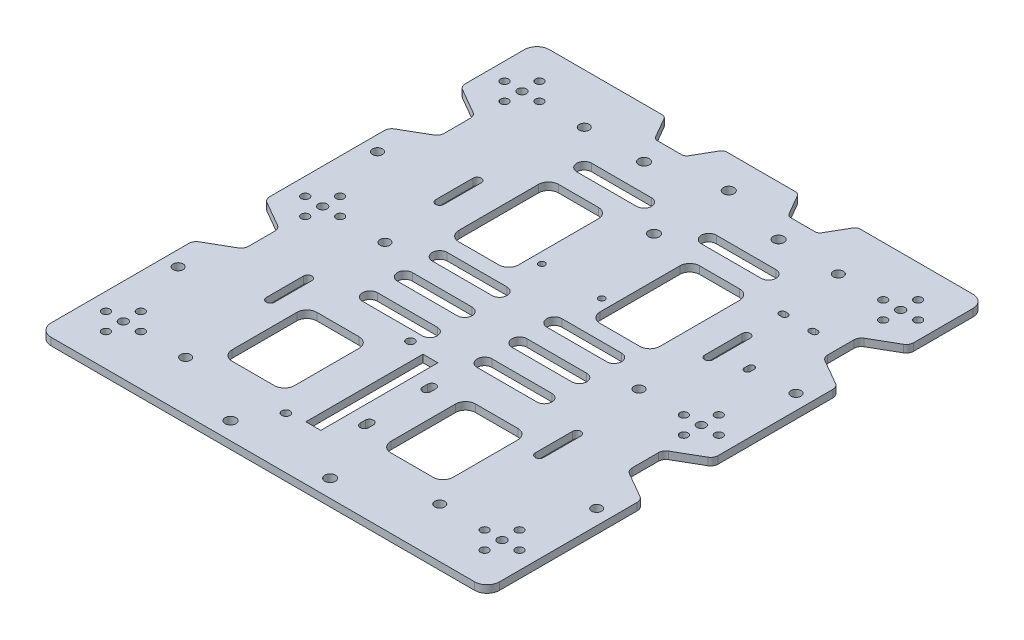
from build123d import *

# Parameters (mm, degrees)
SKETCH_1_W             = 180
SKETCH_1_H             = 200
SKETCH_1_R             = 1.75
SKETCH_1_R_2           = 1.6
EXTRUDE_1_DEPTH        = 3
SKETCH_2_R             = 2
CUT_EXTRUDE_1_DEPTH    = 3
CUT_EXTRUDE_2502_DEPTH = 7.5
SKETCH_4_R             = 2.15
CUT_EXTRUDE_3175_DEPTH = 7.5
SKETCH_5_W             = 6
SKETCH_5_H             = 47
CUT_EXTRUDE_3418_DEPTH = 7.5
SKETCH_6_R             = 1.65
CUT_EXTRUDE_3868_DEPTH = 10
SKETCH_7_R             = 2.15
CUT_EXTRUDE_4040_DEPTH = 10
SKETCH_8_W             = 24
SKETCH_8_H             = 40
SKETCH_8_W_2           = 25
SKETCH_8_H_2           = 34
CUT_EXTRUDE_4845_DEPTH = 10
CUT_EXTRUDE_7_DEPTH    = 10
CUT_EXTRUDE_8_DEPTH    = 10
FILLET_1_R             = 4
FILLET_2_R             = 3
FILLET_3_R             = 2
FILLET_4_R             = 5
SKETCH_12_R            = 1.25
CUT_EXTRUDE_9_DEPTH    = 10


with BuildPart() as part:
    # 草图1 → 凸台-拉伸1 (new body)
    with BuildSketch(Plane(origin=(0, 0, 0), x_dir=(1, 0, 0), z_dir=(0, 1, 0))):
        Rectangle(SKETCH_1_W, SKETCH_1_H)
        with Locations(Location((-76, 80, 0), (0, 0, 270))):
            Circle(SKETCH_1_R, mode=Mode.SUBTRACT)
        with Locations(Location((-83, 80, 0), (0, 0, 270))):
            Circle(SKETCH_1_R_2, mode=Mode.SUBTRACT)
        with Locations(Location((-76, 87, 0), (0, 0, 270))):
            Circle(SKETCH_1_R_2, mode=Mode.SUBTRACT)
        with Locations(Location((-69, 80, 0), (0, 0, 90))):
            Circle(SKETCH_1_R_2, mode=Mode.SUBTRACT)
        with Locations(Location((-76, 73, 0), (0, 0, 90))):
            Circle(SKETCH_1_R_2, mode=Mode.SUBTRACT)
        with Locations(Location((-76, 0, 0), (0, 0, 270))):
            Circle(SKETCH_1_R, mode=Mode.SUBTRACT)
        with Locations(Location((-83, 0, 0), (0, 0, 270))):
            Circle(SKETCH_1_R_2, mode=Mode.SUBTRACT)
        with Locations(Location((-76, 7, 0), (0, 0, 270))):
            Circle(SKETCH_1_R_2, mode=Mode.SUBTRACT)
        with Locations(Location((-76, -7, 0), (0, 0, 90))):
            Circle(SKETCH_1_R_2, mode=Mode.SUBTRACT)
        with Locations(Location((-69, 0, 0), (0, 0, 90))):
            Circle(SKETCH_1_R_2, mode=Mode.SUBTRACT)
        with Locations(Location((-76, -73, 0), (0, 0, 270))):
            Circle(SKETCH_1_R_2, mode=Mode.SUBTRACT)
        with Locations(Location((-69, -80, 0), (0, 0, 270))):
            Circle(SKETCH_1_R_2, mode=Mode.SUBTRACT)
        with Locations(Location((-76, -80, 0), (0, 0, 90))):
            Circle(SKETCH_1_R, mode=Mode.SUBTRACT)
        with Locations(Location((-83, -80, 0), (0, 0, 90))):
            Circle(SKETCH_1_R_2, mode=Mode.SUBTRACT)
        with Locations(Location((-76, -87, 0), (0, 0, 90))):
            Circle(SKETCH_1_R_2, mode=Mode.SUBTRACT)
        with Locations(Location((76, -87, 0), (0, 0, 270))):
            Circle(SKETCH_1_R_2, mode=Mode.SUBTRACT)
        with Locations(Location((83, -80, 0), (0, 0, 270))):
            Circle(SKETCH_1_R_2, mode=Mode.SUBTRACT)
        with Locations(Location((76, -80, 0), (0, 0, 270))):
            Circle(SKETCH_1_R, mode=Mode.SUBTRACT)
        with Locations(Location((69, -80, 0), (0, 0, 90))):
            Circle(SKETCH_1_R_2, mode=Mode.SUBTRACT)
        with Locations(Location((76, -73, 0), (0, 0, 90))):
            Circle(SKETCH_1_R_2, mode=Mode.SUBTRACT)
        with Locations(Location((69, 0, 0), (0, 0, 270))):
            Circle(SKETCH_1_R_2, mode=Mode.SUBTRACT)
        with Locations(Location((76, -7, 0), (0, 0, 270))):
            Circle(SKETCH_1_R_2, mode=Mode.SUBTRACT)
        with Locations(Location((76, 7, 0), (0, 0, 90))):
            Circle(SKETCH_1_R_2, mode=Mode.SUBTRACT)
        with Locations(Location((83, 0, 0), (0, 0, 90))):
            Circle(SKETCH_1_R_2, mode=Mode.SUBTRACT)
        with Locations(Location((76, 0, 0), (0, 0, 90))):
            Circle(SKETCH_1_R, mode=Mode.SUBTRACT)
        with Locations(Location((76, 73, 0), (0, 0, 270))):
            Circle(SKETCH_1_R_2, mode=Mode.SUBTRACT)
        with Locations(Location((69, 80, 0), (0, 0, 270))):
            Circle(SKETCH_1_R_2, mode=Mode.SUBTRACT)
        with Locations(Location((76, 87, 0), (0, 0, 90))):
            Circle(SKETCH_1_R_2, mode=Mode.SUBTRACT)
        with Locations(Location((83, 80, 0), (0, 0, 90))):
            Circle(SKETCH_1_R_2, mode=Mode.SUBTRACT)
        with Locations(Location((76, 80, 0), (0, 0, 90))):
            Circle(SKETCH_1_R, mode=Mode.SUBTRACT)
    extrude(amount=EXTRUDE_1_DEPTH)

    # 草图2 → 切除-拉伸1 (cut)
    with BuildSketch(Plane(origin=(0, 3, 0), x_dir=(1, 0, 0), z_dir=(0, 1, 0))):
        with Locations(Location((-84, 30, 0), (0, 0, 270))):
            Circle(SKETCH_2_R)
        with Locations(Location((-84, -50, 0), (0, 0, 270))):
            Circle(SKETCH_2_R)
        with Locations(Location((-51, 0, 0), (0, 0, 270))):
            Circle(SKETCH_2_R)
        with Locations(Location((-51, -80, 0), (0, 0, 270))):
            Circle(SKETCH_2_R)
        with Locations(Location((-51, 80, 0), (0, 0, 90))):
            Circle(SKETCH_2_R)
        with Locations(Location((51, 80, 0), (0, 0, 270))):
            Circle(SKETCH_2_R)
        with Locations(Location((51, -80, 0), (0, 0, 90))):
            Circle(SKETCH_2_R)
        with Locations(Location((51, 0, 0), (0, 0, 90))):
            Circle(SKETCH_2_R)
        with Locations(Location((84, -50, 0), (0, 0, 90))):
            Circle(SKETCH_2_R)
        with Locations(Location((84, 30, 0), (0, 0, 90))):
            Circle(SKETCH_2_R)
    extrude(amount=-CUT_EXTRUDE_1_DEPTH, mode=Mode.SUBTRACT)

    # 草图3 → Cut-Extrude 2502 (cut)
    with BuildSketch(Plane(origin=(0, 3, 0), x_dir=(1, 0, 0), z_dir=(0, 1, 0))):
        with BuildLine():
            Line((-55.65, 25), (-55.65, 40))
            ThreePointArc((-55.65, 40), (-54, 41.65), (-52.35, 40))
            Line((-52.35, 40), (-52.35, 25))
            ThreePointArc((-52.35, 25), (-54, 23.35), (-55.65, 25))
        make_face()
        with BuildLine():
            Line((-55.65, -43), (-55.65, -28))
            ThreePointArc((-55.65, -28), (-54, -26.35), (-52.35, -28))
            Line((-52.35, -28), (-52.35, -43))
            ThreePointArc((-52.35, -43), (-54, -44.65), (-55.65, -43))
        make_face()
        with BuildLine():
            Line((55.65, -43), (55.65, -28))
            ThreePointArc((55.65, -28), (54, -26.35), (52.35, -28))
            Line((52.35, -28), (52.35, -43))
            ThreePointArc((52.35, -43), (54, -44.65), (55.65, -43))
        make_face()
        with BuildLine():
            Line((55.65, 25), (55.65, 40))
            ThreePointArc((55.65, 40), (54, 41.65), (52.35, 40))
            Line((52.35, 40), (52.35, 25))
            ThreePointArc((52.35, 25), (54, 23.35), (55.65, 25))
        make_face()
    extrude(amount=-CUT_EXTRUDE_2502_DEPTH, mode=Mode.SUBTRACT)

    # 草图4 → Cut-Extrude 3175 (cut)
    with BuildSketch(Plane(origin=(0, 3, 0), x_dir=(1, 0, 0), z_dir=(0, 1, 0))):
        with Locations(Location((0, 87, 0), (0, 0, 270))):
            Circle(SKETCH_4_R)
        with Locations(Location((0, 57, 0), (0, 0, 270))):
            Circle(SKETCH_4_R)
        with Locations(Location((-27, 80, 0), (0, 0, 270))):
            Circle(SKETCH_4_R)
        with Locations(Location((27, 80, 0), (0, 0, 90))):
            Circle(SKETCH_4_R)
    extrude(amount=-CUT_EXTRUDE_3175_DEPTH, mode=Mode.SUBTRACT)

    # 草图5 → Cut-Extrude 3418 (cut)
    with BuildSketch(Plane(origin=(0, 3, 0), x_dir=(1, 0, 0), z_dir=(0, 1, 0))):
        with Locations((-1.5, -54.75)):
            Rectangle(SKETCH_5_W, SKETCH_5_H)
    extrude(amount=-CUT_EXTRUDE_3418_DEPTH, mode=Mode.SUBTRACT)

    # 草图6 → Cut-Extrude 3868 (cut)
    with BuildSketch(Plane(origin=(0, 3, 0), x_dir=(1, 0, 0), z_dir=(0, 1, 0))):
        with Locations(Location((-11.5, -29.25, 0), (0, 0, 270))):
            Circle(SKETCH_6_R)
        with Locations(Location((-11.5, -79.25, 0), (0, 0, 90))):
            Circle(SKETCH_6_R)
        with BuildLine():
            Line((6.85, -42.75), (6.85, -40.75))
            ThreePointArc((6.85, -40.75), (8.5, -39.1), (10.15, -40.75))
            Line((10.15, -40.75), (10.15, -42.75))
            ThreePointArc((10.15, -42.75), (8.5, -44.4), (6.85, -42.75))
        make_face()
        with BuildLine():
            Line((6.85, -65.75), (6.85, -67.75))
            ThreePointArc((6.85, -67.75), (8.5, -69.4), (10.15, -67.75))
            Line((10.15, -67.75), (10.15, -65.75))
            ThreePointArc((10.15, -65.75), (8.5, -64.1), (6.85, -65.75))
        make_face()
    extrude(amount=-CUT_EXTRUDE_3868_DEPTH, mode=Mode.SUBTRACT)

    # 草图7 → Cut-Extrude 4040 (cut)
    with BuildSketch(Plane(origin=(0, 3, 0), x_dir=(1, 0, 0), z_dir=(0, 1, 0))):
        with Locations(Location((-20, -93, 0), (0, 0, 270))):
            Circle(SKETCH_7_R)
        with Locations(Location((20, -93, 0), (0, 0, 90))):
            Circle(SKETCH_7_R)
    extrude(amount=-CUT_EXTRUDE_4040_DEPTH, mode=Mode.SUBTRACT)

    # 草图8 → Cut-Extrude 4845 (cut)
    with BuildSketch(Plane(origin=(0, 3, 0), x_dir=(1, 0, 0), z_dir=(0, 1, 0))):
        with Locations((-28.35, 35)):
            Rectangle(SKETCH_8_W, SKETCH_8_H)
        with Locations((-31.85, -55)):
            Rectangle(SKETCH_8_W_2, SKETCH_8_H_2)
        with Locations((31.85, -55)):
            Rectangle(SKETCH_8_W_2, SKETCH_8_H_2)
        with Locations((28.35, 35)):
            Rectangle(SKETCH_8_W, SKETCH_8_H)
        with BuildLine():
            Line((-35, 9), (-11, 9))
            ThreePointArc((-11, 9), (-8, 6), (-11, 3))
            Line((-11, 3), (-35, 3))
            ThreePointArc((-35, 3), (-38, 6), (-35, 9))
        make_face()
        with BuildLine():
            Line((-35, -5), (-11, -5))
            ThreePointArc((-11, -5), (-8, -8), (-11, -11))
            Line((-11, -11), (-35, -11))
            ThreePointArc((-35, -11), (-38, -8), (-35, -5))
        make_face()
        with BuildLine():
            Line((-35, -25), (-11, -25))
            ThreePointArc((-11, -25), (-8, -22), (-11, -19))
            Line((-11, -19), (-35, -19))
            ThreePointArc((-35, -19), (-38, -22), (-35, -25))
        make_face()
        with BuildLine():
            Line((35, -25), (11, -25))
            ThreePointArc((11, -25), (8, -22), (11, -19))
            Line((11, -19), (35, -19))
            ThreePointArc((35, -19), (38, -22), (35, -25))
        make_face()
        with BuildLine():
            Line((35, -5), (11, -5))
            ThreePointArc((11, -5), (8, -8), (11, -11))
            Line((11, -11), (35, -11))
            ThreePointArc((35, -11), (38, -8), (35, -5))
        make_face()
        with BuildLine():
            Line((35, 9), (11, 9))
            ThreePointArc((11, 9), (8, 6), (11, 3))
            Line((11, 3), (35, 3))
            ThreePointArc((35, 3), (38, 6), (35, 9))
        make_face()
        with BuildLine():
            Line((-37, 69), (-13, 69))
            ThreePointArc((-13, 69), (-10, 66), (-13, 63))
            Line((-13, 63), (-37, 63))
            ThreePointArc((-37, 63), (-40, 66), (-37, 69))
        make_face()
        with BuildLine():
            Line((37, 69), (13, 69))
            ThreePointArc((13, 69), (10, 66), (13, 63))
            Line((13, 63), (37, 63))
            ThreePointArc((37, 63), (40, 66), (37, 69))
        make_face()
    extrude(amount=-CUT_EXTRUDE_4845_DEPTH, mode=Mode.SUBTRACT)

    # 草图10 → 切除-拉伸7 (cut)
    with BuildSketch(Plane(origin=(0, 3, 0), x_dir=(1, 0, 0), z_dir=(0, 1, 0))):
        Polygon((-38.547005384, 100), (-32.773502692, 90), (-20.773502692, 90), (-15, 100), align=None)
        Polygon((38.547005384, 100), (32.773502692, 90), (20.773502692, 90), (15, 100), align=None)
    extrude(amount=-CUT_EXTRUDE_7_DEPTH, mode=Mode.SUBTRACT)

    # 草图11 → 切除-拉伸8 (cut)
    with BuildSketch(Plane(origin=(0, 3, 0), x_dir=(1, 0, 0), z_dir=(0, 1, 0))):
        Polygon((-90, 69.505553499), (-77, 62), (-77, 48), (-90, 40.494446501), align=None)
        Polygon((-90, -8.988893001), (-90, -38), (-77, -30.494446501), (-77, -16.494446501), align=None)
        Polygon((77, -16.494446501), (90, -8.988893001), (90, -38), (77, -30.494446501), align=None)
        Polygon((90, 40.494446501), (90, 69.505553499), (77, 62), (77, 48), align=None)
    extrude(amount=-CUT_EXTRUDE_8_DEPTH, mode=Mode.SUBTRACT)

    # 圆角1
    fillet_1_edges = [part.edges().sort_by_distance(p)[0] for p in [
        (40.35, 1.5, -55),
        (40.35, 1.5, -15),
        (16.35, 1.5, -15),
        (16.35, 1.5, -55),
        (44.35, 1.5, 38),
        (44.35, 1.5, 72),
        (19.35, 1.5, 72),
        (19.35, 1.5, 38),
        (-19.35, 1.5, 38),
        (-19.35, 1.5, 72),
        (-44.35, 1.5, 72),
        (-44.35, 1.5, 38),
        (-16.35, 1.5, -55),
        (-16.35, 1.5, -15),
        (-40.35, 1.5, -15),
        (-40.35, 1.5, -55),
    ]]
    fillet(fillet_1_edges, radius=FILLET_1_R)

    # 圆角2
    fillet_2_edges = [part.edges().sort_by_distance(p)[0] for p in [
        (-90, 1.5, -40.494446501),
        (-90, 1.5, -69.505553499),
        (-90, 1.5, 38),
        (-90, 1.5, 8.988893001),
        (90, 1.5, 38),
        (90, 1.5, 8.988893001),
        (90, 1.5, -69.505553499),
        (90, 1.5, -40.494446501),
        (77, 1.5, -48),
        (77, 1.5, -62),
        (77, 1.5, 30.494446501),
        (77, 1.5, 16.494446501),
        (-77, 1.5, 16.494446501),
        (-77, 1.5, 30.494446501),
        (-77, 1.5, -62),
        (-77, 1.5, -48),
    ]]
    fillet(fillet_2_edges, radius=FILLET_2_R)

    # 圆角3
    fillet_3_edges = [part.edges().sort_by_distance(p)[0] for p in [
        (15, 1.5, -100),
        (38.547005384, 1.5, -100),
        (-38.547005384, 1.5, -100),
        (-15, 1.5, -100),
        (-20.773502692, 1.5, -90),
        (-32.773502692, 1.5, -90),
        (32.773502692, 1.5, -90),
        (20.773502692, 1.5, -90),
    ]]
    fillet(fillet_3_edges, radius=FILLET_3_R)

    # 圆角4
    fillet_4_edges = [part.edges().sort_by_distance(p)[0] for p in [
        (90, 1.5, 100),
        (-90, 1.5, 100),
        (-90, 1.5, -100),
        (90, 1.5, -100),
    ]]
    fillet(fillet_4_edges, radius=FILLET_4_R)

    # 草图12 → 切除-拉伸9 (cut)
    with BuildSketch(Plane.XZ):
        with Locations(Location((12.03, -24, 0), (0, 0, 270))):
            Circle(SKETCH_12_R)
        with Locations(Location((-12.03, -24, 0), (0, 0, 270))):
            Circle(SKETCH_12_R)
        with BuildLine():
            Line((53.5, -53.75), (54.5, -53.75))
            ThreePointArc((54.5, -53.75), (55.75, -55), (54.5, -56.25))
            Line((54.5, -56.25), (53.5, -56.25))
            ThreePointArc((53.5, -56.25), (52.25, -55), (53.5, -53.75))
        make_face()
        with BuildLine():
            Line((65.5, -53.75), (66.5, -53.75))
            ThreePointArc((66.5, -53.75), (67.75, -55), (66.5, -56.25))
            Line((66.5, -56.25), (65.5, -56.25))
            ThreePointArc((65.5, -56.25), (64.25, -55), (65.5, -53.75))
        make_face()
        with BuildLine():
            Line((67.25, -28.5), (67.25, -30))
            ThreePointArc((67.25, -30), (66, -31.25), (64.75, -30))
            Line((64.75, -30), (64.75, -28.5))
            ThreePointArc((64.75, -28.5), (66, -27.25), (67.25, -28.5))
        make_face()
    extrude(amount=-CUT_EXTRUDE_9_DEPTH, mode=Mode.SUBTRACT)


solid = part.part
